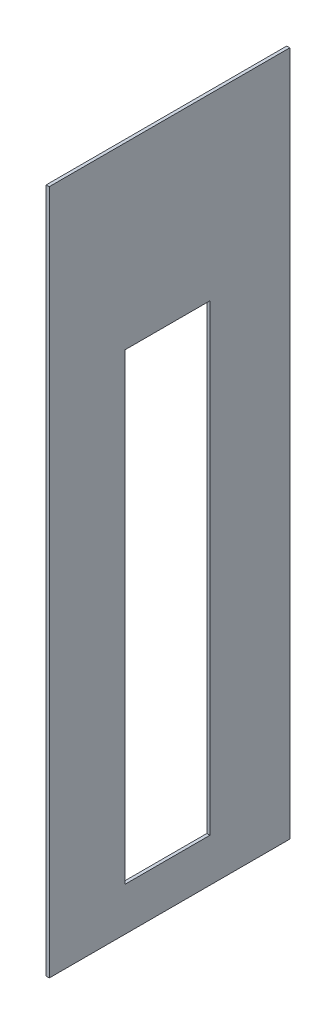
from build123d import *

# Parameters (mm, degrees)
SKETCH_1_W          = 110.7
SKETCH_1_H          = 38.85
EXTRUDE_1_DEPTH     = 0.5
CUT_EXTRUDE_1_DEPTH = 110.343655509


with BuildPart() as part:
    # Эскиз1 → Бобышка-Вытянуть1 (new body)
    with BuildSketch(Plane(origin=(0.5, 0, 0), x_dir=(0, -1, 0), z_dir=(-1, 0, 0))):
        with Locations((-45.5, 22.825)):
            Rectangle(SKETCH_1_W, SKETCH_1_H)
    extrude(amount=-EXTRUDE_1_DEPTH)

    # Эскиз3 → Вырез-Вытянуть1 (cut, through all)
    with BuildSketch(Plane.ZY.offset(-0.5)):
        Polygon((30.006561442, -2.853434514), (16.303695676, -2.853435113), (16.303695676, 71.907533256), (30.006561442, 71.907533256), align=None)
    extrude(amount=-CUT_EXTRUDE_1_DEPTH, mode=Mode.SUBTRACT)


solid = part.part
